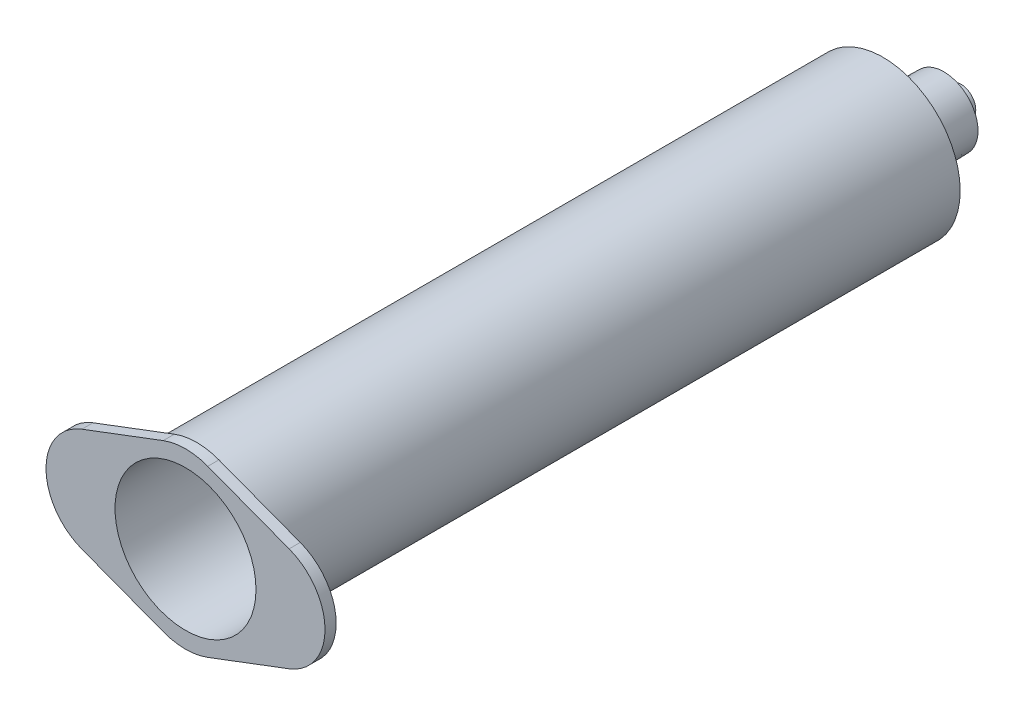
from build123d import *

# Parameters (mm, degrees)
SKETCH1_R           = 10.4
SKETCH1_R_2         = 9.5
BOSS_EXTRUDE1_DEPTH = 92.5
SKETCH3_R           = 9.5
BOSS_EXTRUDE2_DEPTH = 1.5


with BuildPart() as part:
    # Sketch1 → Boss-Extrude1 (new body)
    with BuildSketch(Plane.XY):
        Circle(SKETCH1_R)
        Circle(SKETCH1_R_2, mode=Mode.SUBTRACT)
    extrude(amount=BOSS_EXTRUDE1_DEPTH)

    # Sketch2 → Revolve1 (revolve)
    with BuildSketch(Plane(origin=(0, 0, 0), x_dir=(0, 0, -1), z_dir=(1, 0, 0)), mode=Mode.PRIVATE) as revolve1_sk:
        Polygon((0, 10.4), (1.2, 4.8), (8.2, 4.6), (8.2, 3.8), (2.2, 3.8), (2.2, 2), (10.5, 2), (10.5, 0.97), (1.2, 0.97), (1.2, 3.9), (0, 9.5), align=None)
    revolve(revolve1_sk.sketch.rotate(Axis((0, 0, 0), (0, 0, -1)), 90), axis=Axis((0, 0, 0), (0, 0, -1)))

    # Sketch3 → Boss-Extrude2 (add)
    with BuildSketch(Plane.XY.offset(92.5)):
        with BuildLine():
            Line((-3, 11.151145138), (-13.965196483, 7))
            ThreePointArc((-13.965196483, 7), (-18.8, 0), (-13.965196483, -7))
            Line((-13.965196483, -7), (-3, -11.151145138))
            ThreePointArc((-3, -11.151145138), (0, -11.7), (3, -11.151145138))
            Line((3, -11.151145138), (13.965196483, -7))
            ThreePointArc((13.965196483, -7), (18.8, 0), (13.965196483, 7))
            Line((13.965196483, 7), (3, 11.151145138))
            ThreePointArc((3, 11.151145138), (0, 11.7), (-3, 11.151145138))
        make_face()
        Circle(SKETCH3_R, mode=Mode.SUBTRACT)
    extrude(amount=BOSS_EXTRUDE2_DEPTH)


solid = part.part
